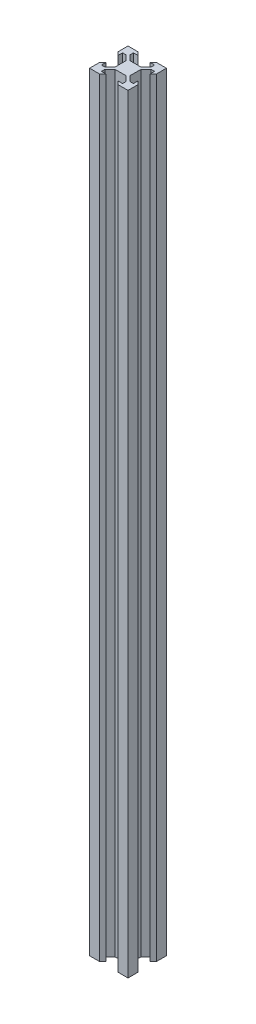
from build123d import *

# Parameters (mm, degrees)
BOSS_EXTRUDE1_DEPTH = 400


with BuildPart() as part:
    # Sketch1 → Boss-Extrude1 (new body)
    with BuildSketch(Plane(origin=(0, 0, 0), x_dir=(1, 0, 0), z_dir=(0, 1, 0))):
        Polygon((2.834320347, 3.893970342), (-2.834320347, 3.893970342), (-5.5, 6.558849663), (-5.5, 8.349069506), (-3.1, 8.349069506), (-4.75, 9.998574117), (-10, 9.998574117), (-10, 4.746997406), (-8.35, 3.097492795), (-8.350720674, 5.497492687), (-6.560500912, 5.498030255), (-3.894821259, 2.833150935), (-3.894821259, -2.833150935), (-6.560500912, -5.498030255), (-8.350720674, -5.497492687), (-8.35, -3.097492795), (-10, -4.746997406), (-10, -9.998574117), (-4.75, -9.998574117), (-3.1, -8.349069506), (-5.5, -8.349069506), (-5.5, -6.558849663), (-2.834320347, -3.893970342), (2.834320347, -3.893970342), (5.5, -6.558849663), (5.5, -8.349069506), (3.1, -8.349069506), (4.75, -9.998574117), (10, -9.998574117), (10, -4.746997406), (8.35, -3.097492795), (8.350720674, -5.497492687), (6.560500912, -5.498030255), (3.894821259, -2.833150935), (3.894821259, 2.833150935), (6.560500912, 5.498030255), (8.350720674, 5.497492687), (8.35, 3.097492795), (10, 4.746997406), (10, 9.998574117), (4.75, 9.998574117), (3.1, 8.349069506), (5.5, 8.349069506), (5.5, 6.558849663), align=None)
    extrude(amount=BOSS_EXTRUDE1_DEPTH)


solid = part.part
